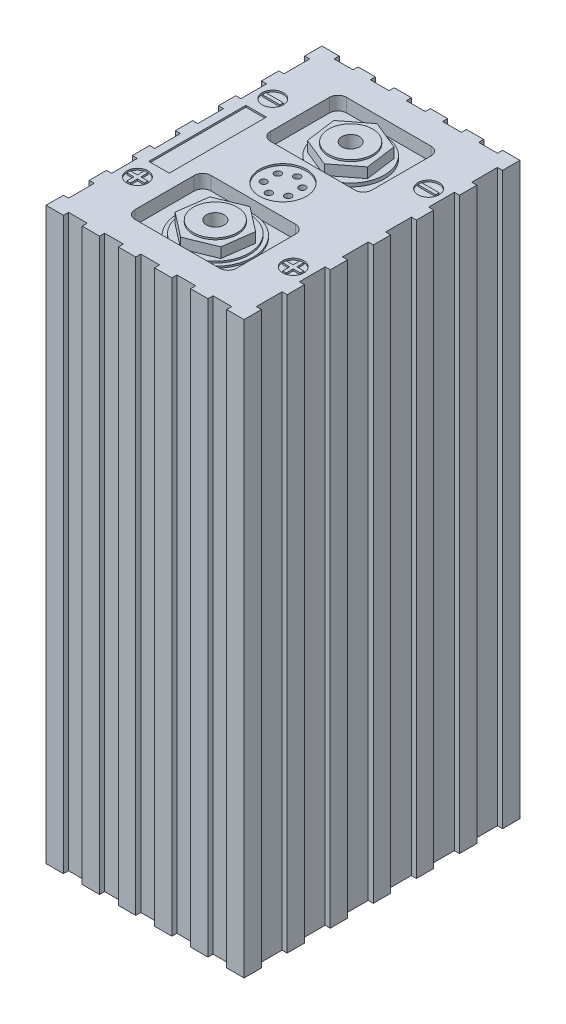
from build123d import *

# Parameters (mm, degrees)
EXTRUDE_1_DEPTH     = 337
SKETCH_2_R          = 1.962053657
SKETCH_2_R_2        = 20
CUT_EXTRUDE_1_DEPTH = 8
SKETCH_4_R          = 20
CUT_EXTRUDE_2_DEPTH = 6
SKETCH_5_R          = 13
EXTRUDE_2_DEPTH     = 1
M12X1_251_D         = 10.5
M12X1_251_DEPTH     = 30.25
M12X1_251_TIP       = 3.15451825
SKETCH_9_W          = 12.084445025
SKETCH_9_H          = 57.39836616
SKETCH_9_R          = 6.249579615
SKETCH_9_W_2        = 10.419260152
SKETCH_9_H_2        = 2.040345212
CUT_EXTRUDE_3_DEPTH = 1
SKETCH_10_R         = 22.257424816
SKETCH_10_R_2       = 13
EXTRUDE_3_DEPTH     = 1
SKETCH_11_R         = 13.860147359
CUT_EXTRUDE_4_DEPTH = 1
SCALE1_SCALE        = 0.5
SCALE2_SCALE        = 0.5


with BuildPart() as part:
    # Эскиз1 → Бобышка-Вытянуть1 (new body)
    with BuildSketch(Plane(origin=(0, 0, 0), x_dir=(1, 0, 0), z_dir=(0, 1, 0))):
        Polygon((5.552371608, 78.5), (-5.552371608, 78.5), (-5.552371608, 81.5), (-15.798418928, 81.5), (-15.798418928, 78.5), (-26.903162144, 78.5), (-26.903162144, 81.5), (-37.149209464, 81.5), (-37.149209464, 78.5), (-48.253952681, 78.5), (-48.253952681, 81.5), (-58.5, 81.5), (-58.5, 71.253952681), (-55.5, 71.253952681), (-55.5, 56.041007887), (-58.5, 56.041007887), (-58.5, 45.794960567), (-55.5, 45.794960567), (-55.5, 30.582015773), (-58.5, 30.582015773), (-58.5, 20.335968454), (-55.5, 20.335968454), (-55.5, 5.12302366), (-58.5, 5.12302366), (-58.5, -5.12302366), (-55.5, -5.12302366), (-55.5, -20.335968454), (-58.5, -20.335968454), (-58.5, -30.582015773), (-55.5, -30.582015773), (-55.5, -45.794960567), (-58.5, -45.794960567), (-58.5, -56.041007887), (-55.5, -56.041007887), (-55.5, -71.253952681), (-58.5, -71.253952681), (-58.5, -81.5), (-48.253952681, -81.5), (-48.253952681, -78.5), (-37.149209464, -78.5), (-37.149209464, -81.5), (-26.903162144, -81.5), (-26.903162144, -78.5), (-15.798418928, -78.5), (-15.798418928, -81.5), (-5.552371608, -81.5), (-5.552371608, -78.5), (5.552371608, -78.5), (5.552371608, -81.5), (15.798418928, -81.5), (15.798418928, -78.5), (26.903162144, -78.5), (26.903162144, -81.5), (37.149209464, -81.5), (37.149209464, -78.5), (48.253952681, -78.5), (48.253952681, -81.5), (58.5, -81.5), (58.5, -71.253952681), (55.5, -71.253952681), (55.5, -56.041007887), (58.5, -56.041007887), (58.5, -45.794960567), (55.5, -45.794960567), (55.5, -30.582015773), (58.5, -30.582015773), (58.5, -20.335968454), (55.5, -20.335968454), (55.5, -5.12302366), (58.5, -5.12302366), (58.5, 5.12302366), (55.5, 5.12302366), (55.5, 20.335968454), (58.5, 20.335968454), (58.5, 30.582015773), (55.5, 30.582015773), (55.5, 45.794960567), (58.5, 45.794960567), (58.5, 56.041007887), (55.5, 56.041007887), (55.5, 71.253952681), (58.5, 71.253952681), (58.5, 81.5), (48.253952681, 81.5), (48.253952681, 78.5), (37.149209464, 78.5), (37.149209464, 81.5), (26.903162144, 81.5), (26.903162144, 78.5), (15.798418928, 78.5), (15.798418928, 81.5), (5.552371608, 81.5), align=None)
    extrude(amount=EXTRUDE_1_DEPTH)

    # Эскиз2 → Вырез-Вытянуть1 (cut)
    # profile 1 of 8: a face of its own
    with BuildSketch(Plane(origin=(0, 337, 0), x_dir=(1, 0, 0), z_dir=(0, 1, 0))):
        with Locations(Location((0, -8.380306925, 0), (0, 0, 270))):
            Circle(SKETCH_2_R)
    # profile 2 of 8: a face of its own
    with BuildSketch(Plane(origin=(0, 337, 0), x_dir=(1, 0, 0), z_dir=(0, 1, 0))):
        with Locations(Location((-7.257558689, -4.190153463, 0), (0, 0, 270))):
            Circle(SKETCH_2_R)
    # profile 3 of 8: a face of its own
    with BuildSketch(Plane(origin=(0, 337, 0), x_dir=(1, 0, 0), z_dir=(0, 1, 0))):
        with Locations(Location((-7.257558689, 4.190153463, 0), (0, 0, 270))):
            Circle(SKETCH_2_R)
    # profile 4 of 8: a face of its own
    with BuildSketch(Plane(origin=(0, 337, 0), x_dir=(1, 0, 0), z_dir=(0, 1, 0))):
        with Locations(Location((0, 8.380306925, 0), (0, 0, 270))):
            Circle(SKETCH_2_R)
    # profile 5 of 8: a face of its own
    with BuildSketch(Plane(origin=(0, 337, 0), x_dir=(1, 0, 0), z_dir=(0, 1, 0))):
        with Locations(Location((7.257558689, 4.190153463, 0), (0, 0, 270))):
            Circle(SKETCH_2_R)
    # profile 6 of 8: a face of its own
    with BuildSketch(Plane(origin=(0, 337, 0), x_dir=(1, 0, 0), z_dir=(0, 1, 0))):
        with Locations(Location((7.257558689, -4.190153463, 0), (0, 0, 270))):
            Circle(SKETCH_2_R)
    # profile 7 of 8: a face of its own
    with BuildSketch(Plane(origin=(0, 337, 0), x_dir=(1, 0, 0), z_dir=(0, 1, 0))):
        with BuildLine():
            Line((-25, -62.5), (25, -62.5))
            ThreePointArc((25, -62.5), (28.535533906, -61.035533906), (30, -57.5))
            Line((30, -57.5), (30, -22.5))
            ThreePointArc((30, -22.5), (28.535533906, -18.964466094), (25, -17.5))
            Line((25, -17.5), (-25, -17.5))
            ThreePointArc((-25, -17.5), (-28.535533906, -18.964466094), (-30, -22.5))
            Line((-30, -22.5), (-30, -57.5))
            ThreePointArc((-30, -57.5), (-28.535533906, -61.035533906), (-25, -62.5))
        make_face()
        with Locations(Location((0, -40, 0), (0, 0, 270))):
            Circle(SKETCH_2_R_2, mode=Mode.SUBTRACT)
    # profile 8 of 8: a face of its own
    with BuildSketch(Plane(origin=(0, 337, 0), x_dir=(1, 0, 0), z_dir=(0, 1, 0))):
        with BuildLine():
            Line((30, 57.5), (30, 22.5))
            ThreePointArc((30, 22.5), (28.535533906, 18.964466094), (25, 17.5))
            Line((25, 17.5), (-25, 17.5))
            ThreePointArc((-25, 17.5), (-28.535533906, 18.964466094), (-30, 22.5))
            Line((-30, 22.5), (-30, 57.5))
            ThreePointArc((-30, 57.5), (-28.535533906, 61.035533906), (-25, 62.5))
            Line((-25, 62.5), (25, 62.5))
            ThreePointArc((25, 62.5), (28.535533906, 61.035533906), (30, 57.5))
        make_face()
        with Locations(Location((0, 40, 0), (0, 0, 90))):
            Circle(SKETCH_2_R_2, mode=Mode.SUBTRACT)
    extrude(amount=-CUT_EXTRUDE_1_DEPTH, mode=Mode.SUBTRACT)

    # Эскиз4 → Вырез-Вытянуть2 (cut)
    # profile 1 of 2: a face of its own
    with BuildSketch(Plane(origin=(0, 337, 0), x_dir=(1, 0, 0), z_dir=(0, 1, 0))):
        with Locations(Location((0, -40, 0), (0, 0, 270))):
            Circle(SKETCH_4_R)
        Polygon((-16.869449006, -46.907951751), (-2.452262798, -58.063347262), (14.417186208, -51.155395511), (16.869449006, -33.092048249), (2.452262798, -21.936652738), (-14.417186208, -28.844604489), align=None, mode=Mode.SUBTRACT)
    # profile 2 of 2: a face of its own
    with BuildSketch(Plane(origin=(0, 337, 0), x_dir=(1, 0, 0), z_dir=(0, 1, 0))):
        with Locations(Location((0, 40, 0), (0, 0, 90))):
            Circle(SKETCH_4_R)
        Polygon((-14.417186208, 28.844604489), (-16.869449006, 46.907951751), (-2.452262798, 58.063347262), (14.417186208, 51.155395511), (16.869449006, 33.092048249), (2.452262798, 21.936652738), align=None, mode=Mode.SUBTRACT)
    extrude(amount=-CUT_EXTRUDE_2_DEPTH, mode=Mode.SUBTRACT)

    # Эскиз5 → Бобышка-Вытянуть2 (add)
    with BuildSketch(Plane(origin=(0, 337, 0), x_dir=(1, 0, 0), z_dir=(0, 1, 0))):
        with Locations(Location((0, 40, 0), (0, 0, 270))):
            Circle(SKETCH_5_R)
        with Locations(Location((0, -40, 0), (0, 0, 270))):
            Circle(SKETCH_5_R)
    extrude(amount=EXTRUDE_2_DEPTH)

    # Отверстие обработанное метчиком M12x1.251
    with Locations(Plane(origin=(0, 338, 0), x_dir=(1, 0, 0), z_dir=(0, 1, 0))):
        with Locations((0, 40), (0, -40)):
            Hole(M12X1_251_D / 2, depth=M12X1_251_DEPTH)
            with Locations((0, 0, -(M12X1_251_DEPTH + M12X1_251_TIP / 2))):  # 118° drill point
                Cone(0, M12X1_251_D / 2, M12X1_251_TIP, mode=Mode.SUBTRACT)

    # Эскиз9 → Вырез-Вытянуть3 (cut)
    # profile 1 of 5: a face of its own
    with BuildSketch(Plane(origin=(0, 337, 0), x_dir=(1, 0, 0), z_dir=(0, 1, 0))):
        with Locations((-44.566124504, 0)):
            Rectangle(SKETCH_9_W, SKETCH_9_H)
    # profile 2 of 5: a face of its own
    with BuildSketch(Plane(origin=(0, 337, 0), x_dir=(1, 0, 0), z_dir=(0, 1, 0))):
        with Locations(Location((-46.037270512, 40, 0), (0, 0, 270))):
            Circle(SKETCH_9_R)
        with Locations((-46.037270512, 40)):
            Rectangle(SKETCH_9_W_2, SKETCH_9_H_2, mode=Mode.SUBTRACT)
    # profile 3 of 5: a face of its own
    with BuildSketch(Plane(origin=(0, 337, 0), x_dir=(1, 0, 0), z_dir=(0, 1, 0))):
        with Locations(Location((-46.037270512, -40, 0), (0, 0, 270))):
            Circle(SKETCH_9_R)
        Polygon((-45.017097906, -38.979827394), (-40.827640436, -38.979827394), (-40.827640436, -41.020172606), (-45.017097906, -41.020172606), (-45.017097906, -45.209630076), (-47.057443118, -45.209630076), (-47.057443118, -41.020172606), (-51.246900588, -41.020172606), (-51.246900588, -38.979827394), (-47.057443118, -38.979827394), (-47.057443118, -34.790369924), (-45.017097906, -34.790369924), align=None, mode=Mode.SUBTRACT)
    # profile 4 of 5: a face of its own
    with BuildSketch(Plane(origin=(0, 337, 0), x_dir=(1, 0, 0), z_dir=(0, 1, 0))):
        with Locations(Location((46.037270512, -40, 0), (0, 0, 270))):
            Circle(SKETCH_9_R)
        Polygon((45.017097906, -38.979827394), (45.017097906, -34.790369924), (47.057443118, -34.790369924), (47.057443118, -38.979827394), (51.246900588, -38.979827394), (51.246900588, -41.020172606), (47.057443118, -41.020172606), (47.057443118, -45.209630076), (45.017097906, -45.209630076), (45.017097906, -41.020172606), (40.827640436, -41.020172606), (40.827640436, -38.979827394), align=None, mode=Mode.SUBTRACT)
    # profile 5 of 5: a face of its own
    with BuildSketch(Plane(origin=(0, 337, 0), x_dir=(1, 0, 0), z_dir=(0, 1, 0))):
        with Locations(Location((46.037270512, 40, 0), (0, 0, 270))):
            Circle(SKETCH_9_R)
        with Locations((46.037270512, 40)):
            Rectangle(SKETCH_9_W_2, SKETCH_9_H_2, mode=Mode.SUBTRACT)
    extrude(amount=-CUT_EXTRUDE_3_DEPTH, mode=Mode.SUBTRACT)

    # Эскиз10 → Бобышка-Вытянуть3 (add)
    with BuildSketch(Plane(origin=(0, 329, 0), x_dir=(1, 0, 0), z_dir=(0, 1, 0))):
        with Locations(Location((0, -40, 0), (0, 0, 270))):
            Circle(SKETCH_10_R)
        with Locations(Location((0, -40, 0), (0, 0, 270))):
            Circle(SKETCH_10_R_2, mode=Mode.SUBTRACT)
    extrude(amount=EXTRUDE_3_DEPTH)

    # Эскиз11 → Вырез-Вытянуть4 (cut)
    with BuildSketch(Plane(origin=(0, 337, 0), x_dir=(1, 0, 0), z_dir=(0, 1, 0))):
        with Locations(Location((0, 0, 0), (0, 0, 270))):
            Circle(SKETCH_11_R)
    extrude(amount=-CUT_EXTRUDE_4_DEPTH, mode=Mode.SUBTRACT)


with BuildPart() as part_1:
    # Scale1: scaled about (0.00507059, 167.598904511, 0.002190658)
    add(part.part.scale(SCALE1_SCALE).moved(Location((0.002535295, 83.799452256, 0.001095329))))


with BuildPart() as part_2:
    # Scale2: scaled about (0.00507059, 167.598904511, 0.002190658)
    add(part_1.part.scale(SCALE2_SCALE).moved(Location((0.002535295, 83.799452256, 0.001095329))))


solid = part_2.part
